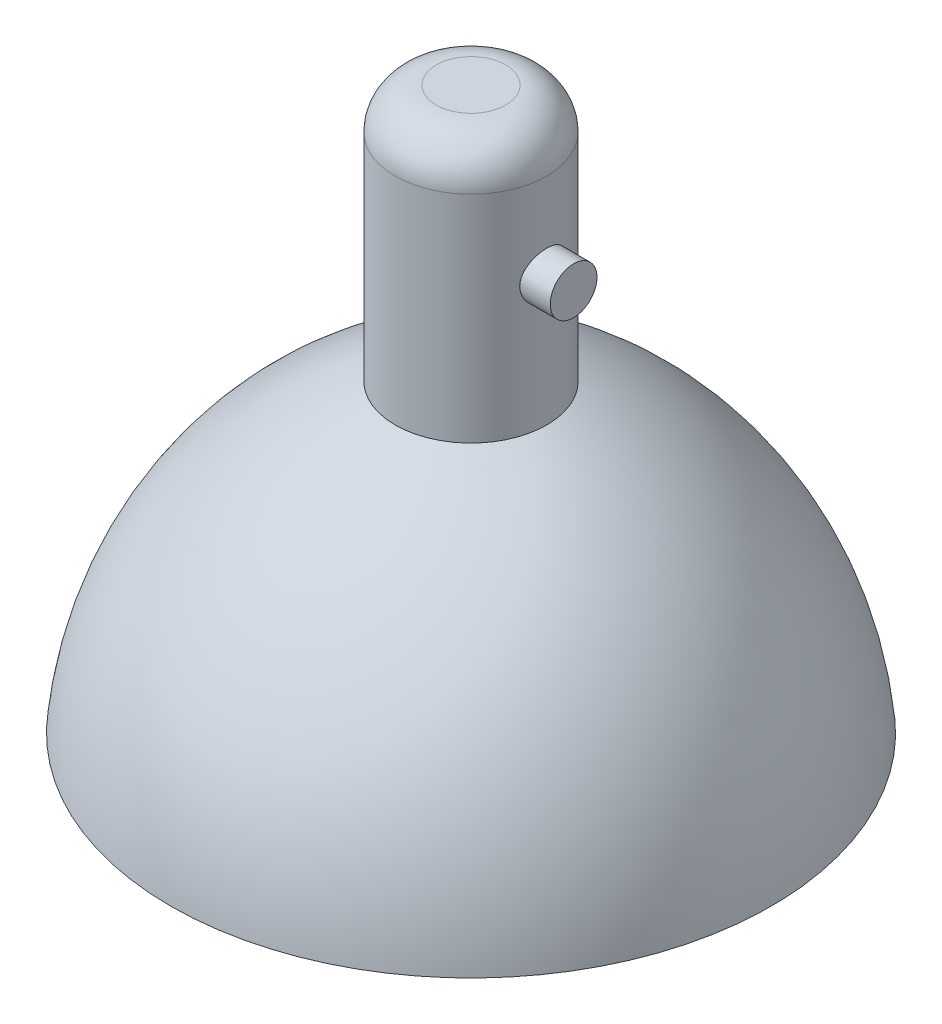
from build123d import *

# Parameters (mm, degrees)
SHELL_1_T       = -2
SKETCH_4_R      = 7.385297863
EXTRUDE_1_DEPTH = 25
FILLET_1_R      = 4
SKETCH_5_R      = 2.277696926
EXTRUDE_2_DEPTH = 10


with BuildPart() as part:
    # 草图2 → 旋转1 (revolve)
    with BuildSketch(Plane.XY, mode=Mode.PRIVATE) as revolve_1_sk:
        with BuildLine():
            Line((0, 0), (29.253375884, 0))
            ThreePointArc((29.253375884, 0), (22.447823433, 17.880245703), (7.385297863, 29.675967555))
            Line((7.385297863, 29.675967555), (0, 29.675967555))
            Line((0, 29.675967555), (0, 0))
        make_face()
    revolve(revolve_1_sk.sketch.rotate(Axis((0, 0, 0), (0, 1, 0)), 90), axis=Axis((0, 0, 0), (0, 1, 0)))

    # 抽壳1
    shell_1_openings = [part.faces().sort_by_distance(p)[0] for p in [
        (0, 0, 0),
    ]]
    offset(amount=SHELL_1_T, openings=shell_1_openings, kind=Kind.INTERSECTION)

    # 草图4 → 凸台-拉伸1 (add)
    with BuildSketch(Plane(origin=(0, 29.675967555, 0), x_dir=(1, 0, 0), z_dir=(0, 1, 0))):
        with Locations(Location((0, 0, 0), (0, 0, 270))):
            Circle(SKETCH_4_R)
    extrude(amount=EXTRUDE_1_DEPTH)

    # 圆角1
    fillet_1_edges = [part.edges().sort_by_distance(p)[0] for p in [
        (0, 54.675967555, -7.385297863),
    ]]
    fillet(fillet_1_edges, radius=FILLET_1_R)

    # 草图5 → 凸台-拉伸2 (add)
    with BuildSketch(Plane(origin=(0, 0, 0), x_dir=(0, 0, -1), z_dir=(1, 0, 0))):
        with Locations(Location((0, 42.315325321, 0), (0, 0, 180))):
            Circle(SKETCH_5_R)
    extrude(amount=EXTRUDE_2_DEPTH)


solid = part.part
